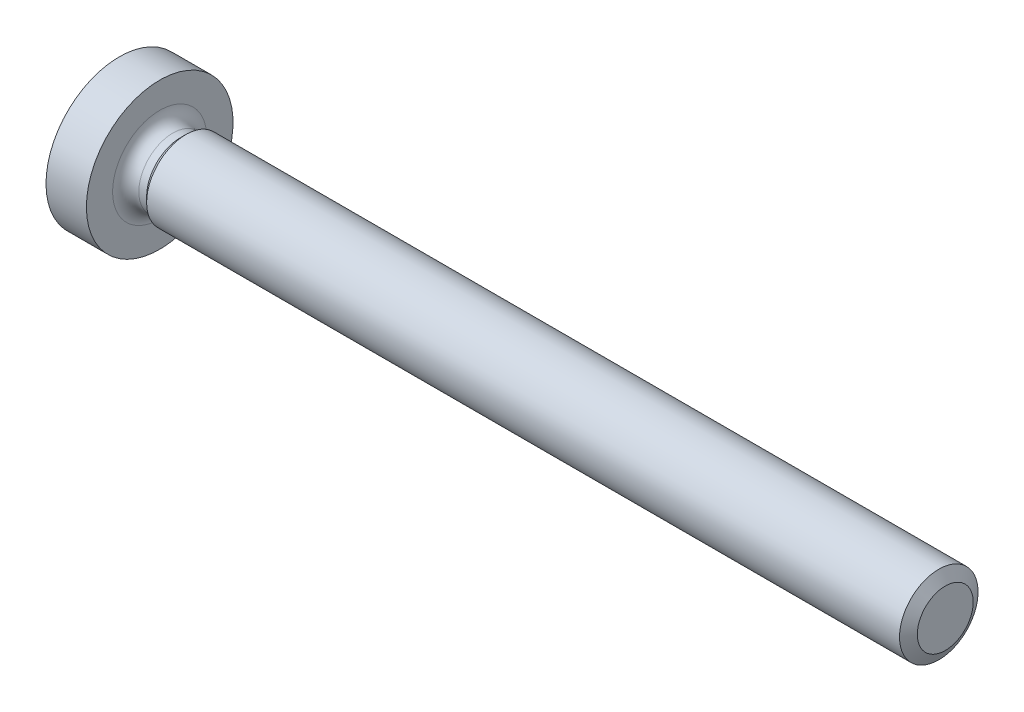
from build123d import *


with BuildPart() as part:
    # 草图2 → Revolve 815 (revolve)
    with BuildSketch(Plane.XY, mode=Mode.PRIVATE) as revolve_815_sk:
        with BuildLine():
            Line((0, 0), (32.4, 0))
            Line((32.4, 0), (32.4, 1.5))
            Line((32.4, 1.5), (3.4, 1.5))
            Line((3.4, 1.5), (3.199, 1.299))
            Line((3.199, 1.299), (2.901, 1.299))
            ThreePointArc((2.901, 1.299), (2.546739503, 1.445739503), (2.4, 1.8))
            Line((2.4, 1.8), (2.4, 2.8))
            Line((2.4, 2.8), (0.857536965, 2.8))
            ThreePointArc((0.857536965, 2.8), (0.219188606, 1.464186604), (0, 0))
        make_face()
    revolve(revolve_815_sk.sketch.rotate(Axis((-1.331757704, 0, 0), (1, 0, 0)), 90), axis=Axis((-1.331757704, 0, 0), (1, 0, 0)))

    # 草图3 → 切除-旋转1 (revolve, cut)
    with BuildSketch(Plane.XY, mode=Mode.PRIVATE) as cut_revolve_1_sk:
        Polygon((32.152708003, 1.5), (32.652708003, 1.5), (32.4, 1.067), align=None)
    revolve(cut_revolve_1_sk.sketch.rotate(Axis((-0.242766179, 0, 0), (1, 0, 0)), 90), axis=Axis((-0.242766179, 0, 0), (1, 0, 0)), mode=Mode.SUBTRACT)

    # 草图5 → 切除-放样1 section 0
    with BuildSketch(Plane(origin=(0, 0, 0), x_dir=(0, 0, -1), z_dir=(1, 0, 0)), mode=Mode.PRIVATE) as loft_1_s0:
        with BuildLine():
            Line((0.25, 1.5), (-0.25, 1.5))
            Line((-0.25, 1.5), (-0.25, -1.5))
            Line((-0.25, -1.5), (0.25, -1.5))
            Line((0.25, -1.5), (0.25, 1.5))
        make_face()
    loft_1 = loft([Vertex(1.8, 0, 0), loft_1_s0.sketch], mode=Mode.SUBTRACT)

    # 镜向1: 切除-放样1 across plane
    add(loft_1.mirror(Plane(origin=(0, 0, 0), x_dir=(0, 0.7071067811865462, 0.7071067811865488), z_dir=(0, -0.7071067811865488, 0.7071067811865462))), mode=Mode.SUBTRACT)


solid = part.part
